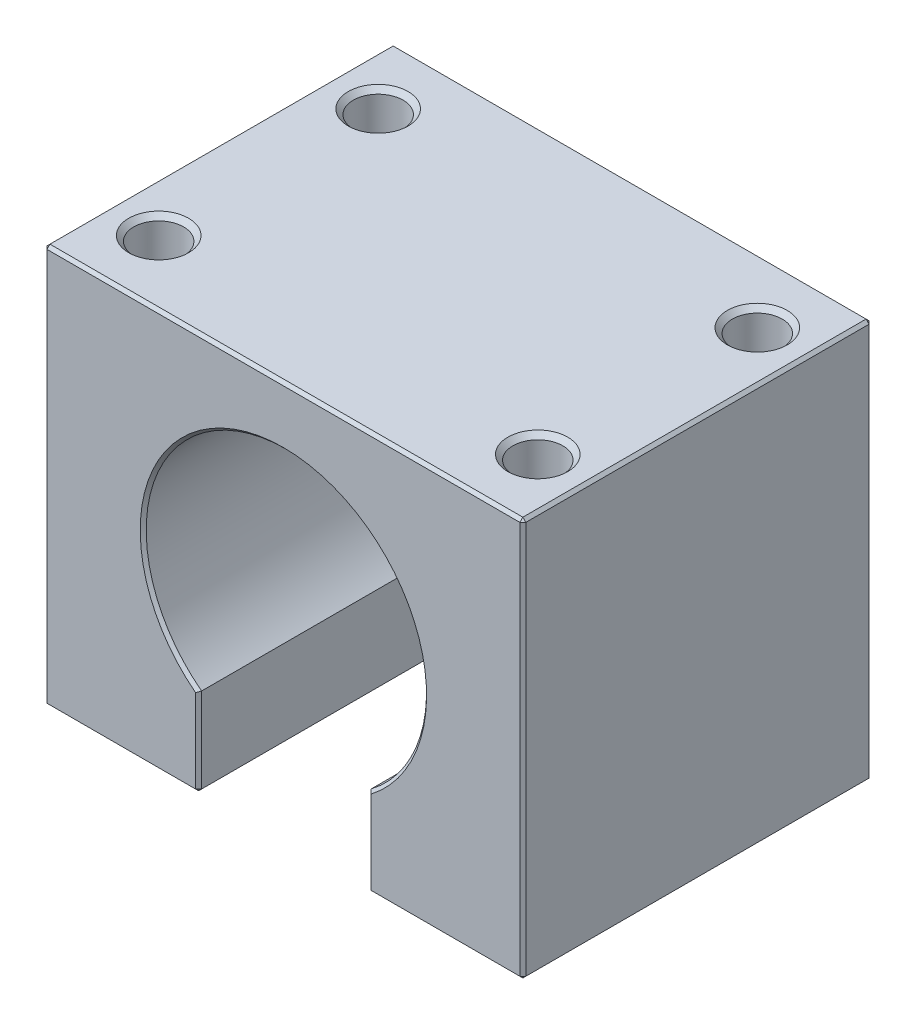
from build123d import *

# Parameters (mm, degrees)
BOSS_EXTRUDE1_DEPTH = 35
CHAMFER2_SIZE       = 0.3
SKETCH2_R           = 2.5
CUT_EXTRUDE1_DEPTH  = 17
SKETCH3_R           = 2.5
CUT_EXTRUDE2_DEPTH  = 20
CHAMFER3_SIZE       = 0.5


with BuildPart() as part:
    # Sketch1 → Boss-Extrude1 (new body)
    with BuildSketch(Plane.XY):
        with BuildLine():
            Line((24, 0), (-24, 0))
            Line((-24, 0), (-24, -40))
            Line((-24, -40), (-8.5, -40))
            Line((-8.5, -40), (-8.5, -31.187157816))
            ThreePointArc((-8.5, -31.187157816), (0, -5.95), (8.5, -31.187157816))
            Line((8.5, -31.187157816), (8.5, -40))
            Line((8.5, -40), (24, -40))
            Line((24, -40), (24, 0))
        make_face()
    extrude(amount=BOSS_EXTRUDE1_DEPTH)

    # Chamfer2
    chamfer2_edges = [part.edges().sort_by_distance(p)[0] for p in [
        (0, -5.95, 35),
        (-8.5, -35.593578908, 0),
        (-16.25, -40, 0),
        (8.5, -35.593578908, 35),
        (-24, -40, 17.5),
        (-24, 0, 17.5),
        (24, 0, 17.5),
        (24, -40, 17.5),
        (8.5, -40, 17.5),
        (-8.5, -40, 17.5),
        (16.25, -40, 35),
        (24, -20, 35),
        (0, 0, 35),
        (-24, -20, 35),
        (-16.25, -40, 35),
        (-8.5, -35.593578908, 35),
        (-24, -20, 0),
        (0, 0, 0),
        (24, -20, 0),
        (16.25, -40, 0),
        (8.5, -35.593578908, 0),
        (0, -5.95, 0),
    ]]
    chamfer(chamfer2_edges, length=CHAMFER2_SIZE)

    # Sketch2 → Cut-Extrude1 (cut)
    with BuildSketch(Plane(origin=(0, 0, 0), x_dir=(1, 0, 0), z_dir=(0, 1, 0))):
        with Locations(Location((-19, -6.5, 0), (0, 0, 180))):
            Circle(SKETCH2_R)
        with Locations((19, -6.5)):
            Circle(SKETCH2_R)
        with Locations(Location((19, -28.5, 0), (0, 0, 180))):
            Circle(SKETCH2_R)
        with Locations((-19, -28.5)):
            Circle(SKETCH2_R)
    extrude(amount=-CUT_EXTRUDE1_DEPTH, mode=Mode.SUBTRACT)

    # Sketch3 → Cut-Extrude2 (cut)
    with BuildSketch(Plane(origin=(0, 0, 0), x_dir=(-1, 0, 0), z_dir=(0, 0, -1))):
        with Locations((-13.435028843, -33.435028843)):
            Circle(SKETCH3_R)
        with Locations(Location((13.435028843, -33.435028843, 0), (0, 0, 180))):
            Circle(SKETCH3_R)
        with Locations((13.435028843, -6.564971157)):
            Circle(SKETCH3_R)
        with Locations(Location((-13.435028843, -6.564971157, 0), (0, 0, 180))):
            Circle(SKETCH3_R)
        with Locations((-19, -20)):
            Circle(SKETCH3_R)
        with Locations(Location((19, -20, 0), (0, 0, 180))):
            Circle(SKETCH3_R)
    extrude(amount=-CUT_EXTRUDE2_DEPTH, mode=Mode.SUBTRACT)

    # Chamfer3
    chamfer3_edges = [part.edges().sort_by_distance(p)[0] for p in [
        (21.5, 0, 28.5),
        (-21.5, 0, 28.5),
        (15.935028843, -33.435028843, 0),
        (-15.935028843, -33.435028843, 0),
        (-10.935028843, -6.564971157, 0),
        (-21.5, -20, 0),
        (21.5, -20, 0),
        (-16.5, 0, 6.5),
        (16.5, 0, 6.5),
    ]]
    chamfer(chamfer3_edges, length=CHAMFER3_SIZE)


solid = part.part
